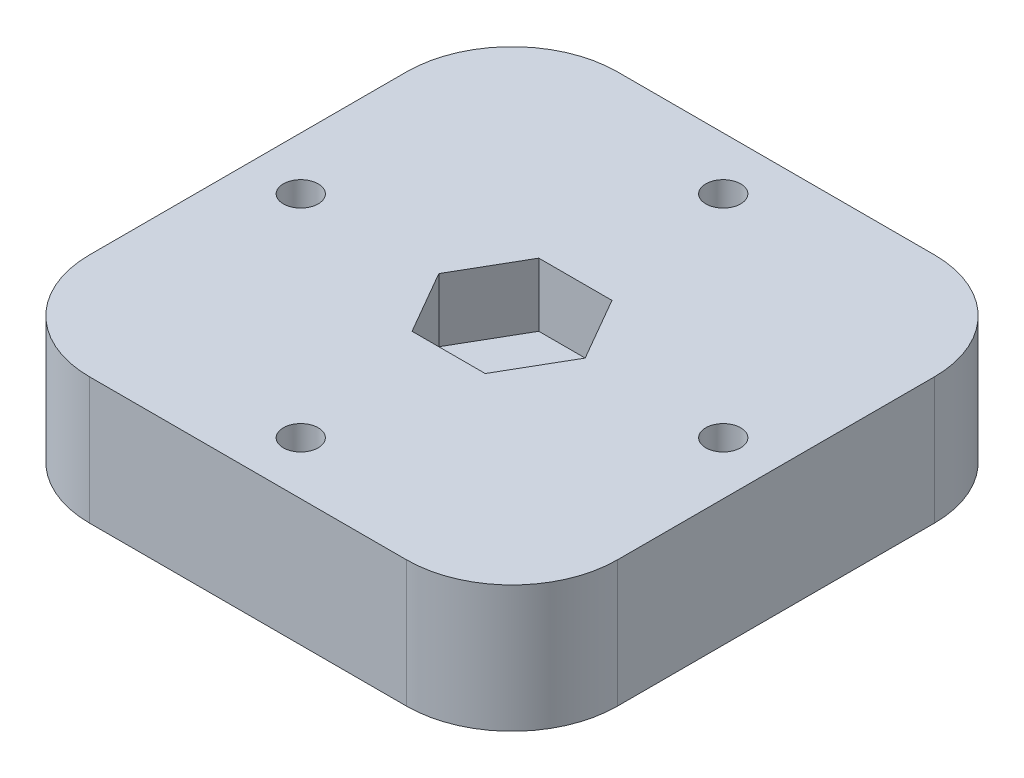
from build123d import *

# Parameters (mm, degrees)
SKETCH1_W           = 50
SKETCH1_H           = 50
BOSS_EXTRUDE1_DEPTH = 12
CUT_EXTRUDE1_DEPTH  = 6
SKETCH4_R           = 1.65
CUT_EXTRUDE2_DEPTH  = 25
FILLET1_R           = 10
SKETCH5_R           = 2
CUT_EXTRUDE4_DEPTH  = 10


with BuildPart() as part:
    # Sketch1 → Boss-Extrude1 (new body)
    with BuildSketch(Plane(origin=(0, 0, 0), x_dir=(1, 0, 0), z_dir=(0, 1, 0))):
        Rectangle(SKETCH1_W, SKETCH1_H)
    extrude(amount=BOSS_EXTRUDE1_DEPTH)

    # Sketch2 → Cut-Extrude1 (cut)
    with BuildSketch(Plane(origin=(0, 12, 0), x_dir=(1, 0, 0), z_dir=(0, 1, 0))):
        Polygon((6.92820323, 0), (3.464101615, 6), (-3.464101615, 6), (-6.92820323, 0), (-3.464101615, -6), (3.464101615, -6), align=None)
    extrude(amount=-CUT_EXTRUDE1_DEPTH, mode=Mode.SUBTRACT)

    # Sketch4 → Cut-Extrude2 (cut)
    with BuildSketch(Plane(origin=(0, 12, 0), x_dir=(1, 0, 0), z_dir=(0, 1, 0))):
        with Locations(Location((0, 20, 0), (0, 0, 270))):
            Circle(SKETCH4_R)
        with Locations(Location((20, 0, 0), (0, 0, 270))):
            Circle(SKETCH4_R)
        with Locations(Location((-20, 0, 0), (0, 0, 270))):
            Circle(SKETCH4_R)
        with Locations(Location((0, -20, 0), (0, 0, 270))):
            Circle(SKETCH4_R)
    extrude(amount=-CUT_EXTRUDE2_DEPTH, mode=Mode.SUBTRACT)

    # Fillet1
    fillet1_edges = [part.edges().sort_by_distance(p)[0] for p in [
        (25, 6, 25),
        (-25, 6, 25),
        (-25, 6, -25),
        (25, 6, -25),
    ]]
    fillet(fillet1_edges, radius=FILLET1_R)

    # Sketch5 → Cut-Extrude4 (cut)
    with BuildSketch(Plane(origin=(0, 0, 0), x_dir=(1, 0, 0), z_dir=(0, 1, 0))):
        with Locations(Location((0, 0, 0), (0, 0, 270))):
            Circle(SKETCH5_R)
    extrude(amount=CUT_EXTRUDE4_DEPTH, mode=Mode.SUBTRACT)


solid = part.part
